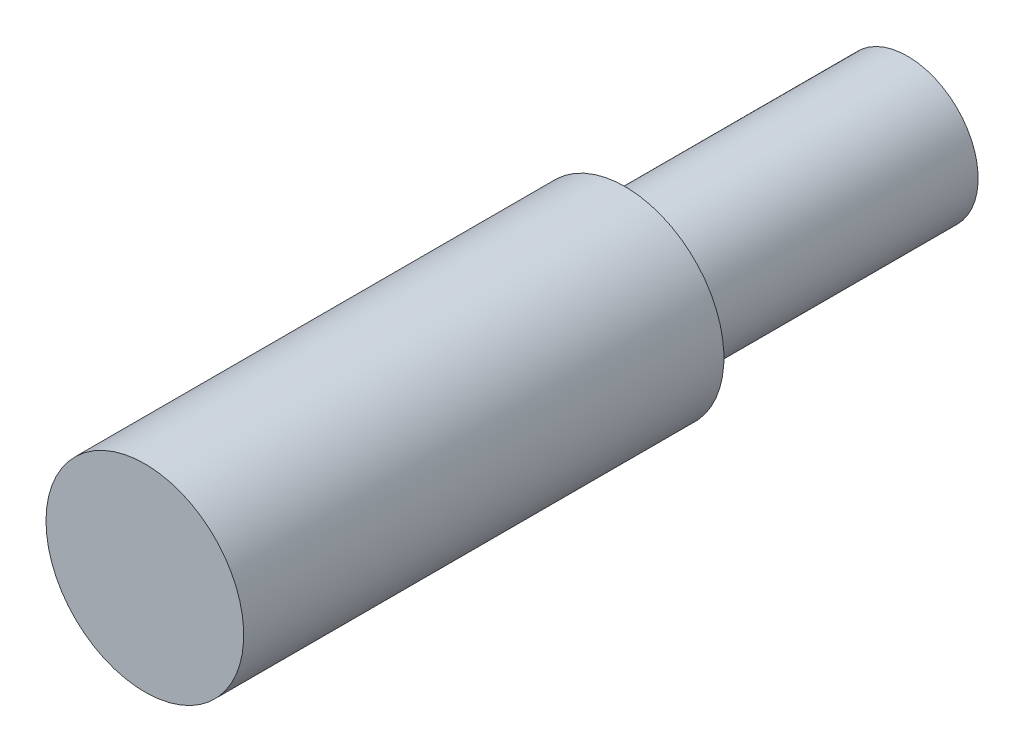
from build123d import *

# Parameters (mm, degrees)
SKETCH2_R           = 7
BOSS_EXTRUDE2_DEPTH = 34
SKETCH3_R           = 5
BOSS_EXTRUDE3_DEPTH = 20
SKETCH4_R           = 3
CUT_EXTRUDE1_DEPTH  = 29


with BuildPart() as part:
    # Sketch2 → Boss-Extrude2 (new body)
    with BuildSketch(Plane(origin=(0, 0, 0), x_dir=(-1, 0, 0), z_dir=(0, 0, -1))):
        with Locations((-15.057769352, -8.761383704)):
            Circle(SKETCH2_R)
    extrude(amount=BOSS_EXTRUDE2_DEPTH)

    # Sketch3 → Boss-Extrude3 (add)
    with BuildSketch(Plane(origin=(0, 0, -34), x_dir=(-1, 0, 0), z_dir=(0, 0, -1))):
        with Locations((-15.057769352, -8.761383704)):
            Circle(SKETCH3_R)
    extrude(amount=BOSS_EXTRUDE3_DEPTH)

    # Sketch4 → Cut-Extrude1 (cut)
    with BuildSketch(Plane(origin=(0, 0, -54), x_dir=(-1, 0, 0), z_dir=(0, 0, -1))):
        with Locations(Location((-15.057769352, -8.761383704, 0), (0, 0, 180))):
            Circle(SKETCH4_R)
    extrude(amount=-CUT_EXTRUDE1_DEPTH, mode=Mode.SUBTRACT)


solid = part.part
